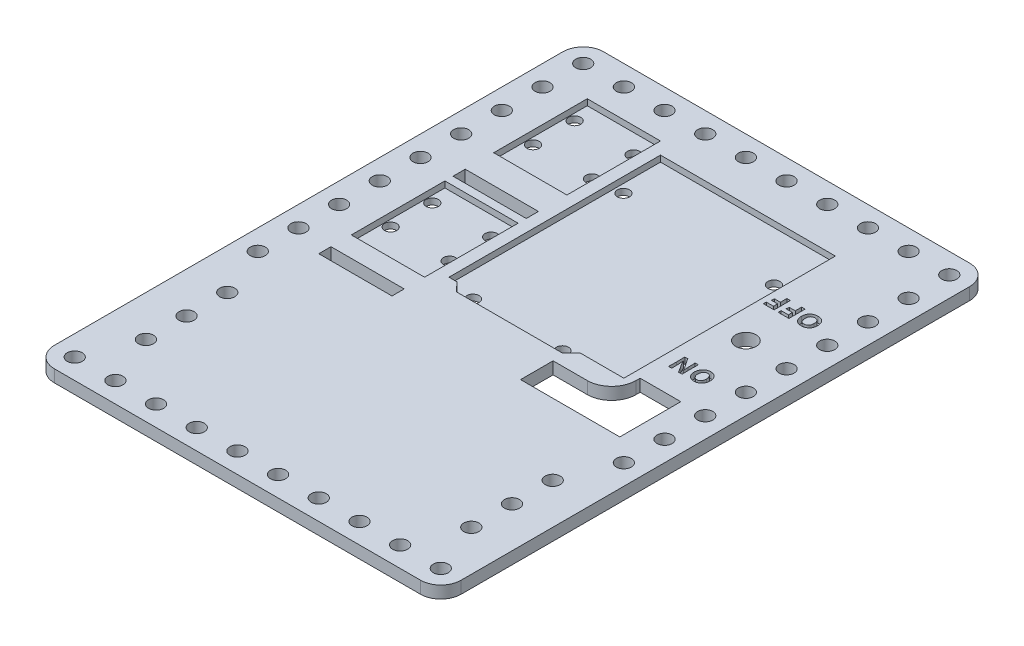
from build123d import *

# Parameters (mm, degrees)
PLATE_EXTRUDE_DEPTH               = 3.81
SKETCH2_R                         = 2.3495
OUTER_HOLE_CUT_DEPTH              = 214.397794272
SKETCH3_R                         = 1.905
ARDUINO_SHAPE_CUT_DEPTH           = 1.905
SKETCH4_W                         = 22.86
SKETCH4_H                         = 29.21
SKETCH4_R                         = 1.905
HG7881_SHAPE_CUT_DEPTH            = 1.905
SKETCH5_R                         = 1.905
ARDUINO_AND_HG7881_HOLE_CUT_DEPTH = 214.397794272
SKETCH6_R                         = 3.175
ON_OFF_TEXT_CUT_DEPTH             = 1.905
SKETCH8_R                         = 3.175
SWITCH_HOLE_CUT_DEPTH             = 214.372284013
BATTERY_WIRE_CUT_DEPTH            = 214.397794411
SKETCH10_W                        = 22.86
SKETCH10_H                        = 3.81
MOTOR_WIRE_CUT_DEPTH              = 214.397794411


with BuildPart() as part:
    # Sketch1 → Plate Extrude (new body)
    with BuildSketch(Plane(origin=(0, 0, 0), x_dir=(1, 0, 0), z_dir=(0, 1, 0))):
        with BuildLine():
            Line((6.35, 0), (120.65, 0))
            ThreePointArc((120.65, 0), (125.140128061, 1.859871939), (127, 6.35))
            Line((127, 6.35), (127, 165.1))
            ThreePointArc((127, 165.1), (125.140128061, 169.590128061), (120.65, 171.45))
            Line((120.65, 171.45), (6.35, 171.45))
            ThreePointArc((6.35, 171.45), (1.859871939, 169.590128061), (0, 165.1))
            Line((0, 165.1), (0, 6.35))
            ThreePointArc((0, 6.35), (1.859871939, 1.859871939), (6.35, 0))
        make_face()
    extrude(amount=PLATE_EXTRUDE_DEPTH)

    # Sketch2 → Outer Hole Cut (cut, through all)
    with BuildSketch(Plane(origin=(0, 3.81, 0), x_dir=(1, 0, 0), z_dir=(0, 1, 0))):
        with Locations(Location((6.35, 165.1, 0), (0, 0, 270))):
            Circle(SKETCH2_R)
        with Locations(Location((19.05, 165.1, 0), (0, 0, 270))):
            Circle(SKETCH2_R)
        with Locations(Location((31.75, 165.1, 0), (0, 0, 270))):
            Circle(SKETCH2_R)
        with Locations(Location((44.45, 165.1, 0), (0, 0, 270))):
            Circle(SKETCH2_R)
        with Locations(Location((57.15, 165.1, 0), (0, 0, 270))):
            Circle(SKETCH2_R)
        with Locations(Location((69.85, 165.1, 0), (0, 0, 270))):
            Circle(SKETCH2_R)
        with Locations(Location((82.55, 165.1, 0), (0, 0, 270))):
            Circle(SKETCH2_R)
        with Locations(Location((95.25, 165.1, 0), (0, 0, 270))):
            Circle(SKETCH2_R)
        with Locations(Location((107.95, 165.1, 0), (0, 0, 270))):
            Circle(SKETCH2_R)
        with Locations(Location((120.65, 165.1, 0), (0, 0, 270))):
            Circle(SKETCH2_R)
        with Locations(Location((6.35, 152.4, 0), (0, 0, 270))):
            Circle(SKETCH2_R)
        with Locations(Location((120.65, 152.4, 0), (0, 0, 270))):
            Circle(SKETCH2_R)
        with Locations(Location((6.35, 139.7, 0), (0, 0, 270))):
            Circle(SKETCH2_R)
        with Locations(Location((120.65, 139.7, 0), (0, 0, 270))):
            Circle(SKETCH2_R)
        with Locations(Location((6.35, 127, 0), (0, 0, 270))):
            Circle(SKETCH2_R)
        with Locations(Location((120.65, 127, 0), (0, 0, 270))):
            Circle(SKETCH2_R)
        with Locations(Location((6.35, 114.3, 0), (0, 0, 270))):
            Circle(SKETCH2_R)
        with Locations(Location((120.65, 114.3, 0), (0, 0, 270))):
            Circle(SKETCH2_R)
        with Locations(Location((6.35, 101.6, 0), (0, 0, 270))):
            Circle(SKETCH2_R)
        with Locations(Location((120.65, 101.6, 0), (0, 0, 270))):
            Circle(SKETCH2_R)
        with Locations(Location((6.35, 88.9, 0), (0, 0, 270))):
            Circle(SKETCH2_R)
        with Locations(Location((120.65, 88.9, 0), (0, 0, 270))):
            Circle(SKETCH2_R)
        with Locations(Location((6.35, 76.2, 0), (0, 0, 270))):
            Circle(SKETCH2_R)
        with Locations(Location((120.65, 76.2, 0), (0, 0, 270))):
            Circle(SKETCH2_R)
        with Locations(Location((6.35, 63.5, 0), (0, 0, 270))):
            Circle(SKETCH2_R)
        with Locations(Location((120.65, 63.5, 0), (0, 0, 270))):
            Circle(SKETCH2_R)
        with Locations(Location((6.35, 6.35, 0), (0, 0, 270))):
            Circle(SKETCH2_R)
        with Locations(Location((19.05, 6.35, 0), (0, 0, 270))):
            Circle(SKETCH2_R)
        with Locations(Location((31.75, 6.35, 0), (0, 0, 270))):
            Circle(SKETCH2_R)
        with Locations(Location((44.45, 6.35, 0), (0, 0, 270))):
            Circle(SKETCH2_R)
        with Locations(Location((57.15, 6.35, 0), (0, 0, 270))):
            Circle(SKETCH2_R)
        with Locations(Location((69.85, 6.35, 0), (0, 0, 270))):
            Circle(SKETCH2_R)
        with Locations(Location((82.55, 6.35, 0), (0, 0, 270))):
            Circle(SKETCH2_R)
        with Locations(Location((95.25, 6.35, 0), (0, 0, 270))):
            Circle(SKETCH2_R)
        with Locations(Location((107.95, 6.35, 0), (0, 0, 270))):
            Circle(SKETCH2_R)
        with Locations(Location((120.65, 6.35, 0), (0, 0, 270))):
            Circle(SKETCH2_R)
        with Locations(Location((12.7, 22.225, 0), (0, 0, 270))):
            Circle(SKETCH2_R)
        with Locations(Location((12.7, 34.925, 0), (0, 0, 270))):
            Circle(SKETCH2_R)
        with Locations(Location((12.7, 47.625, 0), (0, 0, 270))):
            Circle(SKETCH2_R)
        with Locations(Location((114.3, 47.625, 0), (0, 0, 270))):
            Circle(SKETCH2_R)
        with Locations(Location((114.3, 34.925, 0), (0, 0, 270))):
            Circle(SKETCH2_R)
        with Locations(Location((114.3, 22.225, 0), (0, 0, 270))):
            Circle(SKETCH2_R)
    extrude(amount=-OUTER_HOLE_CUT_DEPTH, mode=Mode.SUBTRACT)

    # Sketch3 → Arduino Shape Cut (cut)
    with BuildSketch(Plane(origin=(0, 3.81, 0), x_dir=(1, 0, 0), z_dir=(0, 1, 0))):
        Polygon((48.26, 83.566), (81.28, 83.566), (84.074, 86.36), (97.79, 86.36), (97.79, 152.4), (43.18, 152.4), (43.18, 86.36), (45.72, 86.36), align=None)
        with Locations(Location((50.927, 86.106, 0), (0, 0, 270))):
            Circle(SKETCH3_R, mode=Mode.SUBTRACT)
        with Locations(Location((78.867, 86.106, 0), (0, 0, 270))):
            Circle(SKETCH3_R, mode=Mode.SUBTRACT)
        with Locations(Location((45.847, 138.176, 0), (0, 0, 270))):
            Circle(SKETCH3_R, mode=Mode.SUBTRACT)
        with Locations(Location((94.107, 136.906, 0), (0, 0, 270))):
            Circle(SKETCH3_R, mode=Mode.SUBTRACT)
    extrude(amount=-ARDUINO_SHAPE_CUT_DEPTH, mode=Mode.SUBTRACT)

    # Sketch4 → HG7881 Shape Cut (cut)
    # profile 1 of 2: a face of its own
    with BuildSketch(Plane(origin=(0, 3.81, 0), x_dir=(1, 0, 0), z_dir=(0, 1, 0))):
        with Locations((27.94, 141.605)):
            Rectangle(SKETCH4_W, SKETCH4_H)
        with Locations(Location((37.004970647, 137.183397888, 0), (0, 0, 270))):
            Circle(SKETCH4_R, mode=Mode.SUBTRACT)
        with Locations(Location((37.004970647, 150.182885458, 0), (0, 0, 270))):
            Circle(SKETCH4_R, mode=Mode.SUBTRACT)
        with Locations(Location((18.605695933, 150.182885458, 0), (0, 0, 270))):
            Circle(SKETCH4_R, mode=Mode.SUBTRACT)
        with Locations(Location((18.605695933, 137.183397888, 0), (0, 0, 270))):
            Circle(SKETCH4_R, mode=Mode.SUBTRACT)
    # profile 2 of 2: a face of its own
    with BuildSketch(Plane(origin=(0, 3.81, 0), x_dir=(1, 0, 0), z_dir=(0, 1, 0))):
        with Locations((27.94, 97.155)):
            Rectangle(SKETCH4_W, SKETCH4_H)
        with Locations(Location((37.004970647, 92.733397888, 0), (0, 0, 270))):
            Circle(SKETCH4_R, mode=Mode.SUBTRACT)
        with Locations(Location((37.004970647, 105.732885458, 0), (0, 0, 270))):
            Circle(SKETCH4_R, mode=Mode.SUBTRACT)
        with Locations(Location((18.605695933, 105.732885458, 0), (0, 0, 270))):
            Circle(SKETCH4_R, mode=Mode.SUBTRACT)
        with Locations(Location((18.605695933, 92.733397888, 0), (0, 0, 270))):
            Circle(SKETCH4_R, mode=Mode.SUBTRACT)
    extrude(amount=-HG7881_SHAPE_CUT_DEPTH, mode=Mode.SUBTRACT)

    # Sketch5 → Arduino and HG7881 Hole Cut (cut, through all)
    with BuildSketch(Plane(origin=(0, 3.81, 0), x_dir=(1, 0, 0), z_dir=(0, 1, 0))):
        with Locations(Location((94.107, 136.906, 0), (0, 0, 270))):
            Circle(SKETCH5_R)
        with Locations(Location((78.867, 86.106, 0), (0, 0, 270))):
            Circle(SKETCH5_R)
        with Locations(Location((50.927, 86.106, 0), (0, 0, 270))):
            Circle(SKETCH5_R)
        with Locations(Location((45.847, 138.176, 0), (0, 0, 270))):
            Circle(SKETCH5_R)
        with Locations(Location((18.605695933, 150.182885458, 0), (0, 0, 270))):
            Circle(SKETCH5_R)
        with Locations(Location((37.004970647, 150.182885458, 0), (0, 0, 270))):
            Circle(SKETCH5_R)
        with Locations(Location((37.004970647, 137.183397888, 0), (0, 0, 270))):
            Circle(SKETCH5_R)
        with Locations(Location((18.605695933, 137.183397888, 0), (0, 0, 270))):
            Circle(SKETCH5_R)
        with Locations(Location((18.605695933, 105.732885458, 0), (0, 0, 270))):
            Circle(SKETCH5_R)
        with Locations(Location((18.605695933, 92.733397888, 0), (0, 0, 270))):
            Circle(SKETCH5_R)
        with Locations(Location((37.004970647, 92.733397888, 0), (0, 0, 270))):
            Circle(SKETCH5_R)
        with Locations(Location((37.004970647, 105.732885458, 0), (0, 0, 270))):
            Circle(SKETCH5_R)
    extrude(amount=-ARDUINO_AND_HG7881_HOLE_CUT_DEPTH, mode=Mode.SUBTRACT)

    # Sketch6 → On-Off Text Cut (cut)
    # profile 1 of 6: a face of its own
    with BuildSketch(Plane(origin=(0, 3.81, 0), x_dir=(1, 0, 0), z_dir=(0, 1, 0))):
        with Locations(Location((106.68, 115.57, 0), (0, 0, 270))):
            Circle(SKETCH6_R)
    # profile 2 of 6: a face of its own
    with BuildSketch(Plane(origin=(0, 3.81, 0), x_dir=(1, 0, 0), z_dir=(0, 1, 0))):
        Polygon((99.437371429, 129.171473214), (101.693889286, 129.171473214), (101.693889286, 130.447142857), (99.727657143, 130.447142857), (99.853523214, 131.340678571), (101.693889286, 131.340678571), (101.693889286, 133.35), (102.775657143, 133.35), (102.775657143, 128.27), (99.437371429, 128.27), align=None)
    # profile 3 of 6: a face of its own
    with BuildSketch(Plane(origin=(0, 3.81, 0), x_dir=(1, 0, 0), z_dir=(0, 1, 0))):
        Polygon((104.067428571, 129.171473214), (106.323946429, 129.171473214), (106.323946429, 130.447142857), (104.357714286, 130.447142857), (104.483580357, 131.340678571), (106.323946429, 131.340678571), (106.323946429, 133.35), (107.405714286, 133.35), (107.405714286, 128.27), (104.067428571, 128.27), align=None)
    # profile 4 of 6: a face of its own
    with BuildSketch(Plane(origin=(0, 3.81, 0), x_dir=(1, 0, 0), z_dir=(0, 1, 0))):
        with BuildLine():
            add(Edge.make_bspline(
                [(111.333869643, 133.422571429), (111.400036429, 133.421293644), (111.530264052, 133.418778743), (111.721599638, 133.404606211), (111.905189704, 133.378126371), (112.080972714, 133.342085434), (112.249811922, 133.295795244), (112.410188822, 133.237757182), (112.56375482, 133.170889374), (112.708490415, 133.092309384), (112.845717814, 133.005237576), (112.974334881, 132.909432457), (113.094740592, 132.806319468), (113.206712713, 132.694912539), (113.308131412, 132.57405969), (113.403356697, 132.446908184), (113.488212662, 132.310484017), (113.563748165, 132.16604788), (113.632281169, 132.015770277), (113.689480318, 131.858408066), (113.739904415, 131.695888569), (113.780829795, 131.527040484), (113.81070706, 131.351870875), (113.83367303, 131.171457432), (113.847541782, 130.984842805), (113.849209369, 130.858404304), (113.850057143, 130.794125)],
                knots=[0, 0, 0, 0, 1.155951806, 2.27511212, 3.348946555, 4.393954723, 5.407965168, 6.404192186, 7.370925071, 8.331051299, 9.278033103, 10.207707961, 11.130132865, 12.045226557, 12.963364229, 13.883801961, 14.818154459, 15.766240508, 16.729630475, 17.701042071, 18.688919443, 19.701036391, 20.733368675, 21.791477785, 22.87722277, 24, 24, 24, 24], degree=3))
            add(Edge.make_bspline(
                [(113.850057143, 130.794125), (113.848906268, 130.723415676), (113.846650783, 130.584839579), (113.830807146, 130.381464541), (113.803655066, 130.186799958), (113.765464041, 130.000674458), (113.715246029, 129.823531722), (113.655605416, 129.654880626), (113.583465924, 129.495671763), (113.50234301, 129.345001737), (113.41108714, 129.204043311), (113.31226795, 129.072453114), (113.206641733, 128.94927541), (113.093327301, 128.835899312), (112.972520145, 128.732371499), (112.845157245, 128.638101242), (112.711122269, 128.552318363), (112.569123876, 128.478021474), (112.421764909, 128.412826257), (112.27068682, 128.354325345), (112.115299257, 128.305849976), (111.955941564, 128.265946605), (111.79235473, 128.23525646), (111.624564852, 128.214361204), (111.453183056, 128.19989699), (111.337679665, 128.198255989), (111.279441071, 128.197428571)],
                knots=[0, 0, 0, 0, 1.232878784, 2.416195216, 3.554230057, 4.658068463, 5.726311703, 6.762375074, 7.774173883, 8.770921373, 9.743472943, 10.699106932, 11.638420552, 12.570469205, 13.491194589, 14.409936463, 15.331416347, 16.263022172, 17.201202179, 18.139983866, 19.086323116, 20.037401017, 21.002982729, 21.986393442, 22.984708488, 24, 24, 24, 24], degree=3))
            add(Edge.make_bspline(
                [(111.279441071, 128.197428571), (111.213273297, 128.198699923), (111.083043727, 128.201202161), (110.891348755, 128.215493951), (110.707341451, 128.241734867), (110.531225731, 128.277979812), (110.362636424, 128.323918585), (110.20258477, 128.382788307), (110.048654743, 128.44877322), (109.903698075, 128.527726294), (109.766481954, 128.614787794), (109.637970949, 128.710263657), (109.518441812, 128.813624609), (109.408232239, 128.925490711), (109.305412098, 129.044563325), (109.21296982, 129.172923095), (109.128308478, 129.308838983), (109.052681555, 129.452532716), (108.985946638, 129.603423069), (108.927838811, 129.760537247), (108.879184775, 129.923835762), (108.840002216, 130.093242837), (108.807409716, 130.267881714), (108.786989966, 130.448664016), (108.772427389, 130.635137343), (108.770856008, 130.761589005), (108.770057143, 130.825875)],
                knots=[0, 0, 0, 0, 1.156696468, 2.276577743, 3.357644939, 4.403326298, 5.417989967, 6.408643156, 7.382049269, 8.342794008, 9.290385856, 10.22065961, 11.138675759, 12.049699079, 12.963401745, 13.885853181, 14.811705546, 15.76040235, 16.721714871, 17.693752249, 18.686672155, 19.697909826, 20.732068579, 21.790055059, 22.876499479, 24, 24, 24, 24], degree=3))
            add(Edge.make_bspline(
                [(108.770057143, 130.825875), (108.771206464, 130.89658476), (108.773458903, 131.035161713), (108.789324398, 131.238530612), (108.816397961, 131.433217244), (108.854774203, 131.618807699), (108.903794309, 131.795669576), (108.962645033, 131.964126231), (109.032386679, 132.12416686), (109.115110349, 132.274202466), (109.205284266, 132.415500429), (109.303290757, 132.547534618), (109.407831218, 132.670641911), (109.519985995, 132.784493228), (109.640747152, 132.887192812), (109.767111148, 132.982279292), (109.901099061, 133.067622997), (110.043041207, 133.141992923), (110.190413589, 133.207175556), (110.341494872, 133.265652887), (110.497206242, 133.314345793), (110.65703301, 133.353892206), (110.82058586, 133.384658176), (110.987980111, 133.405720988), (111.159372037, 133.420122315), (111.275253204, 133.421748733), (111.333869643, 133.422571429)],
                knots=[0, 0, 0, 0, 1.233852716, 2.418103927, 3.557037776, 4.661748176, 5.722706476, 6.757383218, 7.77332691, 8.765066384, 9.743935184, 10.696381236, 11.632146327, 12.56027906, 13.481731785, 14.395908616, 15.318116437, 16.250458198, 17.189379335, 18.128902627, 19.075989452, 20.034218859, 21.000563348, 21.978209187, 22.977312867, 24, 24, 24, 24], degree=3))
        make_face()
        with BuildLine():
            add(Edge.make_bspline(
                [(111.333869643, 132.513160714), (111.260356697, 132.511022486), (111.117541046, 132.506868489), (110.912228262, 132.467444284), (110.723064955, 132.404073163), (110.552376597, 132.313848715), (110.39951417, 132.200857268), (110.267975467, 132.064006418), (110.156626043, 131.905342044), (110.067891131, 131.725106566), (109.998896762, 131.526104278), (109.949508152, 131.310172001), (109.919816656, 131.076918765), (109.916108454, 130.915923571), (109.914191071, 130.832678571)],
                knots=[0, 0, 0, 0, 1.058829075, 2.057016769, 3.001336896, 3.925137105, 4.828608669, 5.730369611, 6.649529683, 7.612114954, 8.616840434, 9.679574342, 10.800188823, 12, 12, 12, 12], degree=3))
            add(Edge.make_bspline(
                [(109.914191071, 130.832678571), (109.915327037, 130.766878559), (109.917543635, 130.638483618), (109.933372092, 130.451336623), (109.959899959, 130.275341088), (109.999263424, 130.110717595), (110.046800586, 129.956526213), (110.107502436, 129.814047056), (110.178016873, 129.682400803), (110.259208826, 129.562263883), (110.351555025, 129.454397682), (110.455050487, 129.361321652), (110.568103557, 129.282339821), (110.691217371, 129.218037433), (110.82431679, 129.168601217), (110.967126702, 129.132058011), (111.120015541, 129.110232066), (111.225317862, 129.107991097), (111.279441071, 129.106839286)],
                knots=[0, 0, 0, 0, 1.264720188, 2.467836498, 3.607410022, 4.682410581, 5.718732818, 6.705184373, 7.654411213, 8.585417356, 9.486955331, 10.37694296, 11.253694391, 12.131137943, 13.039326412, 13.976802171, 14.960118255, 16, 16, 16, 16], degree=3))
            add(Edge.make_bspline(
                [(111.279441071, 129.106839286), (111.335835439, 129.107963805), (111.445660251, 129.110153743), (111.605130658, 129.132397386), (111.754467825, 129.1672814), (111.893827821, 129.215550644), (112.021826029, 129.279882734), (112.139532644, 129.357423365), (112.247188969, 129.448928353), (112.343643179, 129.554712323), (112.427774366, 129.673333586), (112.504124023, 129.800646126), (112.565732047, 129.940530934), (112.618197887, 130.089703369), (112.65751171, 130.249670935), (112.685693127, 130.419482433), (112.702863689, 130.59986961), (112.704886161, 130.723782964), (112.705923214, 130.787321429)],
                knots=[0, 0, 0, 0, 1.08085409, 2.104901632, 3.080636972, 4.018233257, 4.92584896, 5.820434128, 6.715107381, 7.628320538, 8.557700034, 9.499963439, 10.469947595, 11.483138428, 12.529113844, 13.62418888, 14.781766574, 16, 16, 16, 16], degree=3))
            add(Edge.make_bspline(
                [(112.705923214, 130.787321429), (112.704776361, 130.853119363), (112.702538517, 130.981510249), (112.686892008, 131.168313502), (112.659874426, 131.344207167), (112.621276707, 131.508645576), (112.57302335, 131.662624589), (112.512522447, 131.805334763), (112.441448923, 131.936960635), (112.359415567, 132.056716931), (112.267521316, 132.164582447), (112.163536671, 132.257359514), (112.051058988, 132.33815621), (111.926516373, 132.401844476), (111.79240037, 132.451433345), (111.648432164, 132.48792879), (111.494425971, 132.509768601), (111.388370919, 132.512009252), (111.333869643, 132.513160714)],
                knots=[0, 0, 0, 0, 1.261902195, 2.462337776, 3.592208748, 4.671870648, 5.698974068, 6.683227656, 7.640165232, 8.563109179, 9.462638388, 10.350642987, 11.229606108, 12.111523837, 13.024477649, 13.966889128, 14.955192282, 16, 16, 16, 16], degree=3))
        make_face(mode=Mode.SUBTRACT)
    # profile 5 of 6: a face of its own
    with BuildSketch(Plane(origin=(0, 3.81, 0), x_dir=(1, 0, 0), z_dir=(0, 1, 0))):
        with BuildLine():
            Line((101.571701087, 101.6), (102.551809783, 101.6))
            add(Edge.make_bspline(
                [(102.551809783, 101.6), (102.553079155, 101.591496576), (102.556215841, 101.570484157), (102.570664261, 101.534679948), (102.591082833, 101.487804539), (102.620097882, 101.430079145), (102.658760832, 101.362405041), (102.704449364, 101.283213598), (102.758562728, 101.193253978), (102.822069529, 101.093545151), (102.893671719, 100.982906434), (102.972802487, 100.86119078), (103.060135034, 100.728571416), (103.157336197, 100.586182156), (103.261555818, 100.432102311), (103.374428056, 100.267691579), (103.495412933, 100.092321927), (103.579399973, 99.972190914), (103.622797101, 99.910117754)],
                knots=[0, 0, 0, 0, 0.205231542, 0.507138232, 0.918114075, 1.43119293, 2.051657812, 2.783675886, 3.619500081, 4.564189586, 5.613081396, 6.773937471, 8.039102956, 9.413756019, 10.900431551, 12.49155187, 14.187142031, 16, 16, 16, 16], degree=3))
            add(Edge.make_bspline(
                [(103.622797101, 99.910117754), (103.668479586, 99.844199803), (103.757538516, 99.715691422), (103.887173245, 99.526789572), (104.007406999, 99.344779881), (104.121663036, 99.171557745), (104.227239447, 99.00548474), (104.32653222, 98.848337094), (104.417180624, 98.69839973), (104.50147074, 98.557301325), (104.577616504, 98.423347164), (104.64618625, 98.297520821), (104.708125137, 98.17985106), (104.760131227, 98.06952422), (104.807399208, 97.968188192), (104.844718413, 97.873750658), (104.876811856, 97.787843498), (104.892374368, 97.73220927), (104.899699275, 97.706023551)],
                knots=[0, 0, 0, 0, 1.506314367, 2.936590399, 4.302859661, 5.603249387, 6.833922843, 7.998884892, 9.094460789, 10.124569346, 11.085756043, 11.988160505, 12.816011405, 13.582674735, 14.278848772, 14.915439517, 15.489522948, 16, 16, 16, 16], degree=3))
            Line((104.899699275, 97.706023551), (104.961818841, 97.706023551))
            add(Edge.make_bspline(
                [(104.961818841, 97.706023551), (104.946818759, 97.845142891), (104.917636661, 98.115794366), (104.888472357, 98.512507451), (104.868464415, 98.888388717), (104.866259214, 99.132448729), (104.865188406, 99.250960145)],
                knots=[0, 0, 0, 0, 1.084104681, 2.109085131, 3.081803711, 4, 4, 4, 4], degree=3))
            add(Edge.make_bspline(
                [(104.865188406, 99.250960145), (104.864853394, 99.333402876), (104.864164663, 99.502892231), (104.86216003, 99.763653748), (104.857114562, 100.03781533), (104.851426739, 100.324640397), (104.844712712, 100.624901996), (104.835498142, 100.938190599), (104.823697584, 101.264872429), (104.81536631, 101.486882095), (104.811121377, 101.6)],
                knots=[0, 0, 0, 0, 0.842047515, 1.73111792, 2.663366491, 3.642676722, 4.661226829, 5.730878757, 6.843842049, 8, 8, 8, 8], degree=3))
            Line((104.811121377, 101.6), (105.807335145, 101.6))
            add(Edge.make_bspline(
                [(105.807335145, 101.6), (105.798340153, 101.393721964), (105.779902851, 100.97090777), (105.762420775, 100.32164218), (105.750178227, 99.642130778), (105.749177957, 99.179260189), (105.748666667, 98.942663043)],
                knots=[0, 0, 0, 0, 0.932070356, 1.910492186, 2.931944271, 4, 4, 4, 4], degree=3))
            add(Edge.make_bspline(
                [(105.748666667, 98.942663043), (105.748984022, 98.826092785), (105.749606211, 98.597551705), (105.751641037, 98.261636471), (105.756127683, 97.939137711), (105.763446337, 97.629703228), (105.770883425, 97.333256256), (105.781762949, 97.050292055), (105.792621981, 96.7806676), (105.802509207, 96.60549933), (105.807335145, 96.52)],
                knots=[0, 0, 0, 0, 1.154308935, 2.263073052, 3.326355064, 4.348015109, 5.328014083, 6.262712885, 7.152033157, 8, 8, 8, 8], degree=3))
            Line((105.807335145, 96.52), (104.613259058, 96.52))
            add(Edge.make_bspline(
                [(104.613259058, 96.52), (104.612465362, 96.530419236), (104.610608174, 96.554799443), (104.59732357, 96.594910597), (104.578967095, 96.644919777), (104.552277637, 96.704417668), (104.517132948, 96.773334817), (104.476051736, 96.852518395), (104.427307278, 96.941471412), (104.371588344, 97.04004313), (104.305826779, 97.147160894), (104.235690568, 97.265215372), (104.156690224, 97.392294054), (104.070432637, 97.529202621), (103.976568865, 97.675742049), (103.874805245, 97.831716708), (103.765421388, 97.997051653), (103.690272663, 98.110942949), (103.651556159, 98.169619565)],
                knots=[0, 0, 0, 0, 0.260950452, 0.610603898, 1.051316961, 1.597493103, 2.241864315, 2.989446012, 3.831961201, 4.782733297, 5.825518036, 6.980323617, 8.222547723, 9.573714243, 11.0339099, 12.581861888, 14.238980645, 16, 16, 16, 16], degree=3))
            add(Edge.make_bspline(
                [(103.651556159, 98.169619565), (103.610117445, 98.232105071), (103.528884883, 98.354595784), (103.410343654, 98.534293609), (103.300245503, 98.707563793), (103.195313826, 98.871665753), (103.097309299, 99.028369859), (103.006451259, 99.17733733), (102.923526743, 99.319626396), (102.846878643, 99.4534804), (102.776017402, 99.579270576), (102.712927248, 99.697504243), (102.656465292, 99.808486231), (102.60556953, 99.911165603), (102.562908939, 100.006864384), (102.5276216, 100.094608093), (102.496298031, 100.173696677), (102.481645329, 100.2251912), (102.474735507, 100.249474638)],
                knots=[0, 0, 0, 0, 1.50202595, 2.944430501, 4.312466267, 5.614511466, 6.846487252, 8.015042657, 9.109869109, 10.145562719, 11.105070242, 12.002023666, 12.829975823, 13.599528891, 14.297593606, 14.928102942, 15.494522073, 16, 16, 16, 16], degree=3))
            Line((102.474735507, 100.249474638), (102.416067029, 100.249474638))
            add(Edge.make_bspline(
                [(102.416067029, 100.249474638), (102.430056431, 100.108414982), (102.457289954, 99.833810564), (102.487565511, 99.432679123), (102.505575403, 99.053649821), (102.508047596, 98.808471711), (102.509246377, 98.689583333)],
                knots=[0, 0, 0, 0, 1.088029335, 2.118094371, 3.087452347, 4, 4, 4, 4], degree=3))
            add(Edge.make_bspline(
                [(102.509246377, 98.689583333), (102.509877649, 98.512037829), (102.511147116, 98.155000068), (102.522576159, 97.615854502), (102.537410559, 97.070092516), (102.554647542, 96.704034859), (102.563313406, 96.52)],
                knots=[0, 0, 0, 0, 0.981596616, 1.973956248, 2.981409976, 4, 4, 4, 4], degree=3))
            Line((102.563313406, 96.52), (101.571701087, 96.52))
            add(Edge.make_bspline(
                [(101.571701087, 96.52), (101.576027919, 96.603204113), (101.584939241, 96.774567039), (101.596554769, 97.039140764), (101.60571566, 97.319079444), (101.612252482, 97.61436467), (101.617973851, 97.924964695), (101.622897424, 98.250514409), (101.624806496, 98.591417), (101.625442679, 98.823792243), (101.625768116, 98.942663043)],
                knots=[0, 0, 0, 0, 0.825064104, 1.699259727, 2.622494583, 3.598657128, 4.624093957, 5.698826761, 6.822842305, 8, 8, 8, 8], degree=3))
            add(Edge.make_bspline(
                [(101.625768116, 98.942663043), (101.625439879, 99.063451119), (101.624790694, 99.302344985), (101.622868855, 99.656284206), (101.617901772, 100.001772538), (101.612213155, 100.338064097), (101.605568015, 100.665936849), (101.596431747, 100.984984082), (101.58474268, 101.295568541), (101.57600477, 101.49953862), (101.571701087, 101.6)],
                knots=[0, 0, 0, 0, 1.090597418, 2.156976447, 3.195727742, 4.210299034, 5.193782273, 6.156671367, 7.092105371, 8, 8, 8, 8], degree=3))
        make_face()
    # profile 6 of 6: a face of its own
    with BuildSketch(Plane(origin=(0, 3.81, 0), x_dir=(1, 0, 0), z_dir=(0, 1, 0))):
        with BuildLine():
            add(Edge.make_bspline(
                [(107.095971014, 98.956467391), (107.098038545, 99.052446973), (107.102088355, 99.240448563), (107.138082301, 99.515939157), (107.193530585, 99.779184697), (107.273236891, 100.030087927), (107.375994757, 100.268320132), (107.501995101, 100.493864353), (107.651373954, 100.706114628), (107.820705927, 100.904265075), (108.007386293, 101.083919763), (108.206322554, 101.242452231), (108.417086875, 101.375664025), (108.638286754, 101.484061209), (108.869511295, 101.570671222), (109.112575111, 101.629117994), (109.365913652, 101.668029128), (109.538807038, 101.671736851), (109.626768116, 101.673623188)],
                knots=[0, 0, 0, 0, 1.110003907, 2.174238483, 3.208849045, 4.21905918, 5.214618782, 6.205710215, 7.202652759, 8.212697272, 9.216731802, 10.195754822, 11.150873912, 12.095299873, 13.041381198, 14.001176956, 14.983080657, 16, 16, 16, 16], degree=3))
            add(Edge.make_bspline(
                [(109.626768116, 101.673623188), (109.710450436, 101.67126115), (109.874611999, 101.666627483), (110.11620657, 101.634587984), (110.346559347, 101.577214136), (110.567847064, 101.501045142), (110.776766692, 101.399360337), (110.976892254, 101.278150592), (111.164992241, 101.132493086), (111.341549596, 100.967098214), (111.503290126, 100.78577192), (111.644071043, 100.589318141), (111.763377018, 100.381245359), (111.860323823, 100.160922666), (111.936749287, 99.928707048), (111.990199949, 99.68394521), (112.023329869, 99.427495515), (112.026904388, 99.252596352), (112.028724638, 99.163532609)],
                knots=[0, 0, 0, 0, 1.033665759, 2.02776626, 3.003104485, 3.961843007, 4.913063737, 5.867569035, 6.847164971, 7.845813918, 8.852406623, 9.843523595, 10.825829756, 11.809813192, 12.811882314, 13.84042391, 14.90028102, 16, 16, 16, 16], degree=3))
            add(Edge.make_bspline(
                [(112.028724638, 99.163532609), (112.026654832, 99.067553968), (112.022600566, 98.87955422), (111.986638688, 98.604050364), (111.931073788, 98.34085305), (111.851742806, 98.089629553), (111.747359185, 97.851903249), (111.621419336, 97.626527521), (111.473523632, 97.413134279), (111.302745322, 97.21611659), (111.11629601, 97.036424917), (110.918261692, 96.877197339), (110.707571291, 96.744385705), (110.486418908, 96.635925511), (110.255181633, 96.549332393), (110.01212129, 96.490881013), (109.758781803, 96.451971134), (109.585888547, 96.448263237), (109.497927536, 96.446376812)],
                knots=[0, 0, 0, 0, 1.110098043, 2.174422874, 3.209121177, 4.219416985, 5.216829017, 6.208004501, 7.202491216, 8.215511247, 9.219630926, 10.195262581, 11.150462672, 12.094968727, 13.041130286, 14.001007442, 14.982994415, 16, 16, 16, 16], degree=3))
            add(Edge.make_bspline(
                [(109.497927536, 96.446376812), (109.414232424, 96.448691985), (109.250045767, 96.453233713), (109.008722487, 96.485926215), (108.777662801, 96.540848428), (108.557406356, 96.619607709), (108.347408432, 96.719440413), (108.147289323, 96.840145055), (107.959300855, 96.985948763), (107.781949856, 97.149815983), (107.621521036, 97.332380171), (107.480591086, 97.528332009), (107.36101928, 97.736713532), (107.264644742, 97.957662188), (107.187901159, 98.19012347), (107.134508425, 98.434909694), (107.101312679, 98.69173367), (107.097775861, 98.867018918), (107.095971014, 98.956467391)],
                knots=[0, 0, 0, 0, 1.03332865, 2.027104945, 3.001009176, 3.961012778, 4.909881577, 5.86812026, 6.840757482, 7.842544561, 8.845673591, 9.83646733, 10.818453131, 11.806448221, 12.808190538, 13.836396696, 14.895908154, 16, 16, 16, 16], degree=3))
        make_face()
        with BuildLine():
            add(Edge.make_bspline(
                [(108.200318841, 99.072653986), (108.201145221, 99.009321516), (108.202762148, 98.88540281), (108.223497198, 98.704818594), (108.25354153, 98.532915858), (108.299021078, 98.370788366), (108.355091262, 98.216915786), (108.424111107, 98.071978993), (108.507754565, 97.937496036), (108.601119268, 97.811828633), (108.706050946, 97.700577684), (108.81481794, 97.599875403), (108.932058338, 97.51696717), (109.054583796, 97.448374478), (109.183181397, 97.395196068), (109.317382772, 97.356774682), (109.457719058, 97.334939155), (109.55307205, 97.331566546), (109.601460145, 97.329855072)],
                knots=[0, 0, 0, 0, 1.216831025, 2.380897632, 3.489863252, 4.568249152, 5.613058355, 6.635127305, 7.647796248, 8.653249441, 9.639055523, 10.583653087, 11.497967932, 12.392213231, 13.277910895, 14.16691524, 15.069777711, 16, 16, 16, 16], degree=3))
            add(Edge.make_bspline(
                [(109.601460145, 97.329855072), (109.64679202, 97.331546544), (109.736067049, 97.33487767), (109.867556137, 97.357039364), (109.993754361, 97.394919169), (110.113665774, 97.449973662), (110.229168689, 97.518273516), (110.338433898, 97.603298967), (110.44349769, 97.702455009), (110.541400243, 97.81625829), (110.632395364, 97.940526288), (110.710195421, 98.075473123), (110.77649153, 98.218287435), (110.829971606, 98.369030326), (110.873206772, 98.527329378), (110.90229184, 98.69371901), (110.921593588, 98.867816853), (110.923436713, 98.986705855), (110.924376812, 99.047346014)],
                knots=[0, 0, 0, 0, 0.902754371, 1.777853262, 2.647603904, 3.519196709, 4.399346334, 5.314325575, 6.270542111, 7.272042485, 8.300124669, 9.333610479, 10.368928787, 11.43182187, 12.515581422, 13.63309649, 14.792744455, 16, 16, 16, 16], degree=3))
            add(Edge.make_bspline(
                [(110.924376812, 99.047346014), (110.922890884, 99.110270005), (110.919985047, 99.233322289), (110.901942481, 99.413871333), (110.869414521, 99.58486791), (110.826126597, 99.747654441), (110.768440125, 99.900896557), (110.69784744, 100.045018845), (110.616239973, 100.181036714), (110.520680169, 100.305466125), (110.4168244, 100.418302803), (110.307552117, 100.518994035), (110.19003061, 100.601713497), (110.068403664, 100.671539356), (109.940046696, 100.724995091), (109.806514514, 100.763051216), (109.666610731, 100.78515617), (109.571627955, 100.788461107), (109.523235507, 100.790144928)],
                knots=[0, 0, 0, 0, 1.210797462, 2.3677995, 3.486359933, 4.556649632, 5.604971398, 6.631173242, 7.640905167, 8.651714714, 9.643826094, 10.589272684, 11.504409335, 12.403069749, 13.282752155, 14.172555557, 15.068941607, 16, 16, 16, 16], degree=3))
            add(Edge.make_bspline(
                [(109.523235507, 100.790144928), (109.477885611, 100.788575032), (109.388509854, 100.785481075), (109.25721709, 100.761543515), (109.131274097, 100.72365991), (109.010381748, 100.670490971), (108.895916544, 100.600283922), (108.786225714, 100.515639957), (108.680875107, 100.416284035), (108.583244276, 100.301420209), (108.492984855, 100.176354764), (108.414095768, 100.042076018), (108.348541301, 99.899657941), (108.294464684, 99.749534016), (108.251534823, 99.591502598), (108.222390923, 99.425135539), (108.203147639, 99.251413094), (108.201272365, 99.132909644), (108.200318841, 99.072653986)],
                knots=[0, 0, 0, 0, 0.903167979, 1.779967091, 2.650116221, 3.518989718, 4.403478452, 5.318876904, 6.275531542, 7.28327132, 8.318020778, 9.3453814, 10.381174052, 11.437365587, 12.521621678, 13.63964875, 14.799828022, 16, 16, 16, 16], degree=3))
        make_face(mode=Mode.SUBTRACT)
    extrude(amount=-ON_OFF_TEXT_CUT_DEPTH, mode=Mode.SUBTRACT)

    # Sketch8 → Switch Hole Cut (cut, through all)
    with BuildSketch(Plane(origin=(0, 1.905, 0), x_dir=(1, 0, 0), z_dir=(0, 1, 0))):
        with Locations(Location((106.68, 115.57, 0), (0, 0, 270))):
            Circle(SKETCH8_R)
    extrude(amount=-SWITCH_HOLE_CUT_DEPTH, mode=Mode.SUBTRACT)

    # Sketch9 → Battery Wire Cut (cut, through all)
    with BuildSketch(Plane(origin=(0, 3.81, 0), x_dir=(1, 0, 0), z_dir=(0, 1, 0))):
        with BuildLine():
            Line((113.03, 69.85), (82.044285714, 69.85))
            Line((82.044285714, 69.85), (82.044285714, 80.01))
            Line((82.044285714, 80.01), (92.71, 80.01))
            ThreePointArc((92.71, 80.01), (98.098153673, 82.241846327), (100.33, 87.63))
            Line((100.33, 87.63), (100.33, 88.9))
            Line((100.33, 88.9), (113.03, 88.9))
            Line((113.03, 88.9), (113.03, 69.85))
        make_face()
    extrude(amount=-BATTERY_WIRE_CUT_DEPTH, mode=Mode.SUBTRACT)

    # Sketch10 → Motor Wire Cut (cut, through all)
    with BuildSketch(Plane(origin=(0, 3.81, 0), x_dir=(1, 0, 0), z_dir=(0, 1, 0))):
        with Locations((27.94, 116.205)):
            Rectangle(SKETCH10_W, SKETCH10_H)
        with Locations((27.94, 74.295)):
            Rectangle(SKETCH10_W, SKETCH10_H)
    extrude(amount=-MOTOR_WIRE_CUT_DEPTH, mode=Mode.SUBTRACT)


solid = part.part
